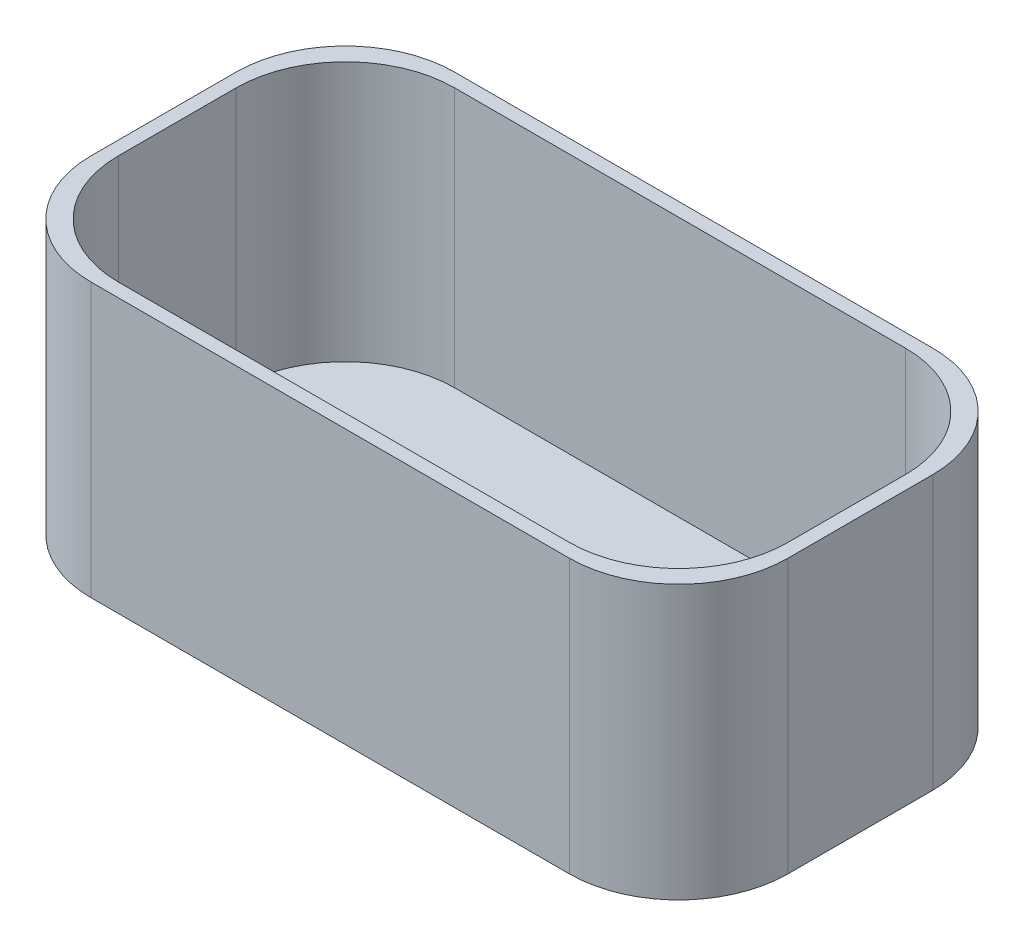
from build123d import *

# Parameters (mm, degrees)
SKETCH_1_W          = 254.9
SKETCH_1_H          = 133
EXTRUDE_1_DEPTH     = 100
SHELL_1_T           = -5
FILLET_1_R          = 40
FILLET_2_R          = 40
CUT_EXTRUDE_1_DEPTH = 100


with BuildPart() as part:
    # 草图1 → 凸台-拉伸1 (new body)
    with BuildSketch(Plane(origin=(0, 0, 0), x_dir=(1, 0, 0), z_dir=(0, 1, 0))):
        Rectangle(SKETCH_1_W, SKETCH_1_H)
    extrude(amount=EXTRUDE_1_DEPTH)

    # 抽壳1
    shell_1_openings = [part.faces().sort_by_distance(p)[0] for p in [
        (0, 100, 0),
    ]]
    offset(amount=SHELL_1_T, openings=shell_1_openings, kind=Kind.INTERSECTION)

    # 圆角1
    fillet_1_edges = [part.edges().sort_by_distance(p)[0] for p in [
        (122.45, 52.5, 61.5),
        (122.45, 52.5, -61.5),
        (-122.45, 52.5, -61.5),
        (-122.45, 52.5, 61.5),
    ]]
    fillet(fillet_1_edges, radius=FILLET_1_R)

    # 圆角2
    fillet_2_edges = [part.edges().sort_by_distance(p)[0] for p in [
        (127.45, 50, 66.5),
        (-127.45, 50, 66.5),
        (-127.45, 50, -66.5),
        (127.45, 50, -66.5),
    ]]
    fillet(fillet_2_edges, radius=FILLET_2_R)

    # 草图2 → 切除-拉伸1 (cut)
    with BuildSketch(Plane(origin=(0, 5, 0), x_dir=(1, 0, 0), z_dir=(0, 1, 0))):
        with BuildLine():
            Line((-25, 17.5), (25, 17.5))
            ThreePointArc((25, 17.5), (42.5, 0), (25, -17.5))
            Line((25, -17.5), (-25, -17.5))
            ThreePointArc((-25, -17.5), (-42.5, 0), (-25, 17.5))
        make_face()
    extrude(amount=-CUT_EXTRUDE_1_DEPTH, mode=Mode.SUBTRACT)


solid = part.part
